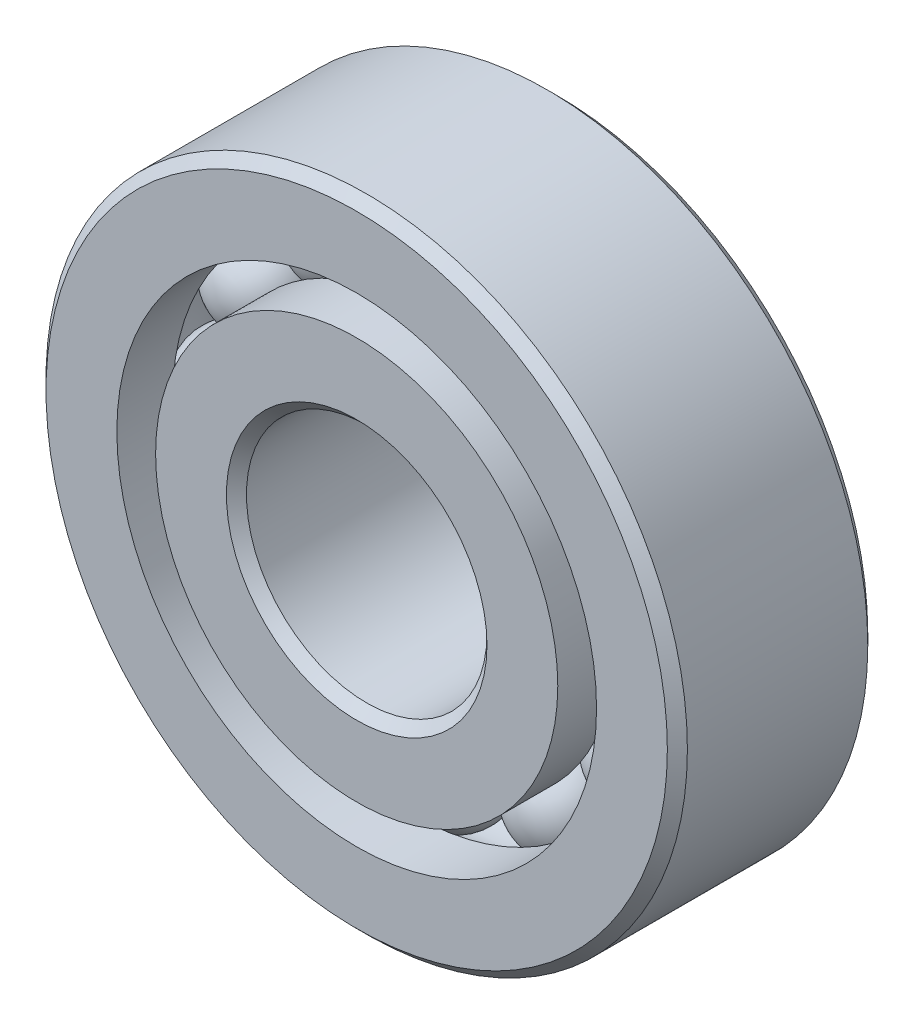
from build123d import *

# Parameters (mm, degrees)
CIRPATTERN1_COUNT = 12


with BuildPart() as part:
    # Sketch1 → Revolve1 (revolve)
    with BuildSketch(Plane(origin=(0, 0, 0), x_dir=(0, 0, -1), z_dir=(1, 0, 0))):
        with BuildLine():
            Line((1.7859375, 6.35), (-1.7859375, 6.35))
            Line((-1.7859375, 6.35), (-1.984375, 6.1515625))
            Line((-1.984375, 6.1515625), (-1.984375, 4.749416209))
            Line((-1.984375, 4.749416209), (-0.881944444, 4.749416209))
            ThreePointArc((-0.881944444, 4.749416209), (0, 5.327457467), (0.881944444, 4.749416209))
            Line((0.881944444, 4.749416209), (1.984375, 4.749416209))
            Line((1.984375, 4.749416209), (1.984375, 6.1515625))
            Line((1.984375, 6.1515625), (1.7859375, 6.35))
        make_face()
    revolve(axis=Axis((0, 0, 1.984375), (0, 0, -1)))


with BuildPart() as body_2:
    # Sketch3 → Revolve3 (revolve)
    with BuildSketch(Plane(origin=(0, 0, 0), x_dir=(0, 0, -1), z_dir=(1, 0, 0))):
        with BuildLine():
            Line((-1.984375, 3.981833791), (-0.881944444, 3.981833791))
            ThreePointArc((-0.881944444, 3.981833791), (0, 3.403792533), (0.881944444, 3.981833791))
            Line((0.881944444, 3.981833791), (1.984375, 3.981833791))
            Line((1.984375, 3.981833791), (1.984375, 2.5796875))
            Line((1.984375, 2.5796875), (1.7859375, 2.38125))
            Line((1.7859375, 2.38125), (-1.7859375, 2.38125))
            Line((-1.7859375, 2.38125), (-1.984375, 2.5796875))
            Line((-1.984375, 2.5796875), (-1.984375, 3.981833791))
        make_face()
    revolve(axis=Axis((0, 0, 1.984375), (0, 0, -1)))


with BuildPart() as body_3:
    # Sketch4 → Revolve4 (revolve)
    with BuildSketch(Plane(origin=(0, 0, 0), x_dir=(0, 0, -1), z_dir=(1, 0, 0))):
        with BuildLine():
            Line((-0.961832467, 4.365625), (0.961832467, 4.365625))
            ThreePointArc((0.961832467, 4.365625), (0, 5.327457467), (-0.961832467, 4.365625))
        make_face()
    revolve(axis=Axis((0, 4.365625, 0.961832467), (0, 0, -1)))


with BuildPart() as cirpattern1_1:
    # CirPattern1: pattern copy
    add(body_3.part.rotate(Axis((0, 0, -1.984375), (0, 0, 1)), 1 * 360 / CIRPATTERN1_COUNT))


with BuildPart() as cirpattern1_2:
    # CirPattern1: pattern copy
    add(body_3.part.rotate(Axis((0, 0, -1.984375), (0, 0, 1)), 2 * 360 / CIRPATTERN1_COUNT))


with BuildPart() as cirpattern1_3:
    # CirPattern1: pattern copy
    add(body_3.part.rotate(Axis((0, 0, -1.984375), (0, 0, 1)), 3 * 360 / CIRPATTERN1_COUNT))


with BuildPart() as cirpattern1_4:
    # CirPattern1: pattern copy
    add(body_3.part.rotate(Axis((0, 0, -1.984375), (0, 0, 1)), 4 * 360 / CIRPATTERN1_COUNT))


with BuildPart() as cirpattern1_5:
    # CirPattern1: pattern copy
    add(body_3.part.rotate(Axis((0, 0, -1.984375), (0, 0, 1)), 5 * 360 / CIRPATTERN1_COUNT))


with BuildPart() as cirpattern1_6:
    # CirPattern1: pattern copy
    add(body_3.part.rotate(Axis((0, 0, -1.984375), (0, 0, 1)), 6 * 360 / CIRPATTERN1_COUNT))


with BuildPart() as cirpattern1_7:
    # CirPattern1: pattern copy
    add(body_3.part.rotate(Axis((0, 0, -1.984375), (0, 0, 1)), 7 * 360 / CIRPATTERN1_COUNT))


with BuildPart() as cirpattern1_8:
    # CirPattern1: pattern copy
    add(body_3.part.rotate(Axis((0, 0, -1.984375), (0, 0, 1)), 8 * 360 / CIRPATTERN1_COUNT))


with BuildPart() as cirpattern1_9:
    # CirPattern1: pattern copy
    add(body_3.part.rotate(Axis((0, 0, -1.984375), (0, 0, 1)), 9 * 360 / CIRPATTERN1_COUNT))


with BuildPart() as cirpattern1_10:
    # CirPattern1: pattern copy
    add(body_3.part.rotate(Axis((0, 0, -1.984375), (0, 0, 1)), 10 * 360 / CIRPATTERN1_COUNT))


with BuildPart() as cirpattern1_11:
    # CirPattern1: pattern copy
    add(body_3.part.rotate(Axis((0, 0, -1.984375), (0, 0, 1)), 11 * 360 / CIRPATTERN1_COUNT))


solid = Compound([part.part, body_2.part, body_3.part, cirpattern1_1.part, cirpattern1_2.part, cirpattern1_3.part, cirpattern1_4.part, cirpattern1_5.part, cirpattern1_6.part, cirpattern1_7.part, cirpattern1_8.part, cirpattern1_9.part, cirpattern1_10.part, cirpattern1_11.part])
